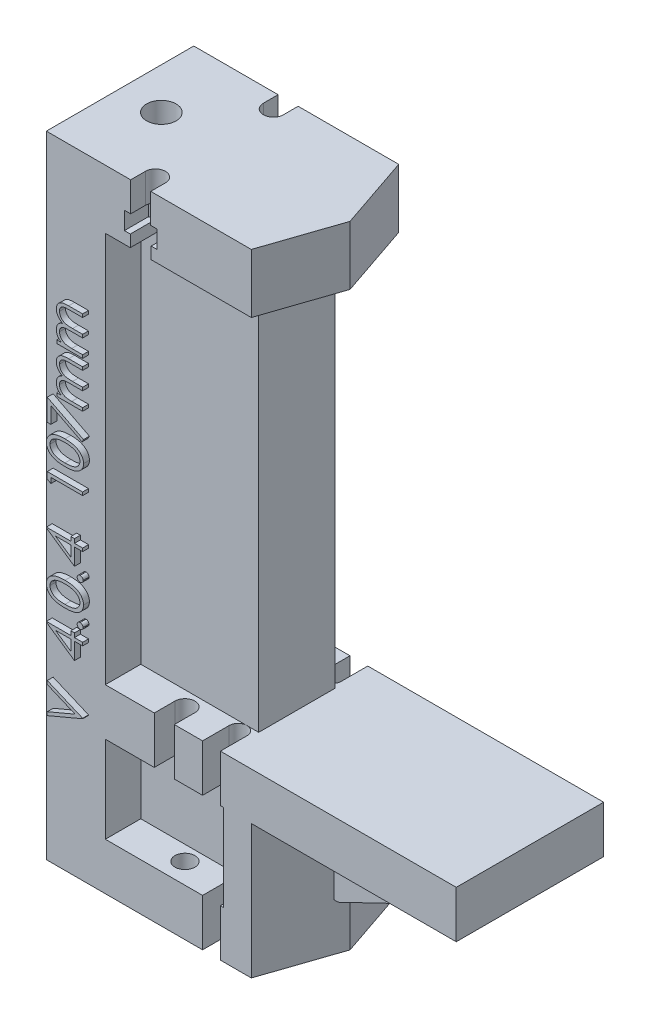
from build123d import *
from build123d.topology import SkipClean

# Parameters (mm, degrees)
BOSS_EXTRUDE2_DEPTH              = 12.5
BOSS_EXTRUDE3_DEPTH              = 25
CUT_EXTRUDE2_REACH               = 112.59
CUT_EXTRUDE3_REACH               = 112.59
CUT_EXTRUDE6_REACH               = 112.59
SKETCH30_W                       = 10
SKETCH30_H                       = 25
CUT_EXTRUDE8_DEPTH               = 8
CUT_EXTRUDE9_DEPTH               = 82.263171394
CUT_EXTRUDE9_DEPTH_BACK          = 82.263171394
BOSS_EXTRUDE6_DEPTH              = 1
BOSS_EXTRUDE7_DEPTH              = 40
BOSS_EXTRUDE17_DEPTH             = 2
CUT_EXTRUDE10_DEPTH              = 3
SKETCH39_W                       = 4
SKETCH39_H                       = 14.695
BOSS_EXTRUDE18_DEPTH             = 2.5
F_5_0MM_DOWEL_HOLE1_D            = 5
F_5_0MM_DOWEL_HOLE1_DEPTH        = 5
F_5_0MM_DOWEL_HOLE1_TIP          = 1.502151548
BOSS_EXTRUDE19_DEPTH             = 2
BOSS_EXTRUDE20_DEPTH             = 8
BOSS_EXTRUDE21_REACH             = 91.364
SKETCH45_W                       = 20
SKETCH45_H                       = 12.98
BOSS_EXTRUDE21_DIRECTION_2_REACH = 91.364


with BuildPart() as part:
    # Sketch6 → Boss-Extrude2 (new, symmetric)
    with BuildSketch(Plane.XY):
        Polygon((-25, 53.5), (15, 53.5), (15, 45.5), (-15, 45.5), (-15, -45.5), (25, -45.5), (25, -53.5), (-25, -53.5), align=None)
    extrude(amount=BOSS_EXTRUDE2_DEPTH, both=True)

    # Sketch15 → Boss-Extrude3 (add)
    with BuildSketch(Plane.XY.offset(12.5)):
        Polygon((-15, -22.805), (15, -22.805), (15, -53.5), (5, -53.5), (5, -30.805), (-15, -30.805), align=None)
    extrude(amount=-BOSS_EXTRUDE3_DEPTH)

    # Sketch20 → Cut-Extrude2 (cut, up to next)
    with BuildSketch(Plane(origin=(0, 53.5, 0), x_dir=(1, 0, 0), z_dir=(0, 1, 0)), mode=Mode.PRIVATE) as cut_extrude2_sk1:
        with BuildLine():
            Line((-10.7, 12.5), (-10.7, 10))
            ThreePointArc((-10.7, 10), (-9, 8.3), (-7.3, 10))
            Line((-7.3, 10), (-7.3, 12.5))
            Line((-7.3, 12.5), (-10.7, 12.5))
        make_face()
    cut_extrude2_tool1 = extrude(cut_extrude2_sk1.sketch, amount=-CUT_EXTRUDE2_REACH, mode=Mode.PRIVATE) & part.part
    # Sketch20 → Cut-Extrude2 (cut, up to next)
    with BuildSketch(Plane(origin=(0, 53.5, 0), x_dir=(1, 0, 0), z_dir=(0, 1, 0)), mode=Mode.PRIVATE) as cut_extrude2_sk2:
        with BuildLine():
            Line((-7.3, -12.5), (-10.7, -12.5))
            Line((-10.7, -12.5), (-10.7, -10))
            ThreePointArc((-10.7, -10), (-9, -8.3), (-7.3, -10))
            Line((-7.3, -10), (-7.3, -12.5))
        make_face()
    cut_extrude2_tool2 = extrude(cut_extrude2_sk2.sketch, amount=-CUT_EXTRUDE2_REACH, mode=Mode.PRIVATE) & part.part
    add(cut_extrude2_tool1.solids().sort_by_distance((-9, 53.5, -10.563642))[0], mode=Mode.SUBTRACT)
    add(cut_extrude2_tool2.solids().sort_by_distance((-9, 53.5, 10.563642))[0], mode=Mode.SUBTRACT)

    # Cut-Extrude3: up to this face of the body (flat: up to its plane)
    cut_extrude3_end = Plane(part.part.faces().sort_by_distance((0, -22.805, 0))[0])
    # Sketch21 → Cut-Extrude3 (cut, up to the picked face)
    with BuildSketch(Plane.XZ.offset(53.5), mode=Mode.PRIVATE) as cut_extrude3_sk1:
        with BuildLine():
            Line((-6.7, 12.5), (-6.7, 9))
            ThreePointArc((-6.7, 9), (-5, 7.3), (-3.3, 9))
            Line((-3.3, 9), (-3.3, 12.5))
            Line((-3.3, 12.5), (-6.7, 12.5))
        make_face()
    cut_extrude3_tool1 = split(extrude(cut_extrude3_sk1.sketch, amount=-CUT_EXTRUDE3_REACH, mode=Mode.PRIVATE), bisect_by=cut_extrude3_end, keep=Keep.BOTH, mode=Mode.PRIVATE)
    # Sketch21 → Cut-Extrude3 (cut, up to the picked face)
    with BuildSketch(Plane.XZ.offset(53.5), mode=Mode.PRIVATE) as cut_extrude3_sk2:
        with BuildLine():
            Line((-3.3, -12.5), (-6.7, -12.5))
            Line((-6.7, -12.5), (-6.7, -9))
            ThreePointArc((-6.7, -9), (-5, -7.3), (-3.3, -9))
            Line((-3.3, -9), (-3.3, -12.5))
        make_face()
    cut_extrude3_tool2 = split(extrude(cut_extrude3_sk2.sketch, amount=-CUT_EXTRUDE3_REACH, mode=Mode.PRIVATE), bisect_by=cut_extrude3_end, keep=Keep.BOTH, mode=Mode.PRIVATE)
    add(cut_extrude3_tool1.solids().sort_by(Axis((-5, -53.5, 10.067524), (0, 1, 0)))[0], mode=Mode.SUBTRACT)
    add(cut_extrude3_tool2.solids().sort_by(Axis((-5, -53.5, -10.067524), (0, 1, 0)))[0], mode=Mode.SUBTRACT)

    # Cut-Extrude6: up to this face of the body (flat: up to its plane)
    cut_extrude6_end = Plane(part.part.faces().sort_by_distance((0.229244521, -22.805, 0))[0])
    # Sketch24 → Cut-Extrude6 (cut, up to the picked face)
    with BuildSketch(Plane.XZ.offset(53.5), mode=Mode.PRIVATE) as cut_extrude6_sk1:
        with BuildLine():
            Line((1.49, -12.5), (1.49, -8))
            ThreePointArc((1.49, -8), (3, -6.49), (4.51, -8))
            Line((4.51, -8), (4.51, -12.5))
            Line((4.51, -12.5), (1.49, -12.5))
        make_face()
    cut_extrude6_tool1 = split(extrude(cut_extrude6_sk1.sketch, amount=-CUT_EXTRUDE6_REACH, mode=Mode.PRIVATE), bisect_by=cut_extrude6_end, keep=Keep.BOTH, mode=Mode.PRIVATE)
    # Sketch24 → Cut-Extrude6 (cut, up to the picked face)
    with BuildSketch(Plane.XZ.offset(53.5), mode=Mode.PRIVATE) as cut_extrude6_sk2:
        with BuildLine():
            Line((4.51, 12.5), (1.49, 12.5))
            Line((1.49, 12.5), (1.49, 8))
            ThreePointArc((1.49, 8), (3, 6.49), (4.51, 8))
            Line((4.51, 8), (4.51, 12.5))
        make_face()
    cut_extrude6_tool2 = split(extrude(cut_extrude6_sk2.sketch, amount=-CUT_EXTRUDE6_REACH, mode=Mode.PRIVATE), bisect_by=cut_extrude6_end, keep=Keep.BOTH, mode=Mode.PRIVATE)
    add(cut_extrude6_tool1.solids().sort_by(Axis((3, -53.5, -9.647036), (0, 1, 0)))[0], mode=Mode.SUBTRACT)
    add(cut_extrude6_tool2.solids().sort_by(Axis((3, -53.5, 9.647036), (0, 1, 0)))[0], mode=Mode.SUBTRACT)

    # Sketch30 → Cut-Extrude8 (cut)
    with BuildSketch(Plane(origin=(0, -45.5, 0), x_dir=(1, 0, 0), z_dir=(0, 1, 0))):
        with Locations((20, 0)):
            Rectangle(SKETCH30_W, SKETCH30_H)
    extrude(amount=-CUT_EXTRUDE8_DEPTH, mode=Mode.SUBTRACT)

    # Sketch34 → Cut-Extrude9 (cut, two sides: drawn at the far end of the back side and taken through both)
    with BuildSketch(Plane(origin=(0, -22.805, 0), x_dir=(1, 0, 0), z_dir=(0, 1, 0)).offset(-CUT_EXTRUDE9_DEPTH_BACK)):
        Polygon((9.755, 12.5), (14, 0), (9.755, -12.5), (15, -12.5), (15, 12.5), align=None)
    extrude(amount=CUT_EXTRUDE9_DEPTH + CUT_EXTRUDE9_DEPTH_BACK, mode=Mode.SUBTRACT)

    # Sketch35 → Boss-Extrude6 (add)
    # profile 1 of 11: a face of its own
    with BuildSketch(Plane.XY.offset(12.5)):
        with BuildLine():
            Line((-22.234615385, 24.192307692), (-22.234615385, 24.730769231))
            Line((-22.234615385, 24.730769231), (-21.472596154, 24.730769231))
            add(Edge.make_bspline(
                [(-21.472596154, 24.730769231), (-21.539260614, 24.779256002), (-21.666996111, 24.872161304), (-21.835322312, 25.024502423), (-21.978170577, 25.176690044), (-22.053158357, 25.286290127), (-22.089182692, 25.338942308)],
                knots=[0, 0, 0, 0, 1.134379233, 2.173579362, 3.122582517, 4, 4, 4, 4], degree=3))
            add(Edge.make_bspline(
                [(-22.089182692, 25.338942308), (-22.123477604, 25.4107103), (-22.191468256, 25.552992414), (-22.260440071, 25.778282514), (-22.302825959, 26.008810519), (-22.308622599, 26.164481742), (-22.311538462, 26.242788462)],
                knots=[0, 0, 0, 0, 1.014936303, 2.012140481, 3.000054389, 4, 4, 4, 4], degree=3))
            add(Edge.make_bspline(
                [(-22.311538462, 26.242788462), (-22.309746507, 26.295747856), (-22.306200324, 26.400551651), (-22.283126386, 26.555839071), (-22.243239974, 26.706452288), (-22.187690322, 26.851510678), (-22.120389321, 26.988153705), (-22.041520642, 27.113523249), (-21.952811526, 27.225533553), (-21.851715073, 27.325979796), (-21.732621113, 27.415508457), (-21.593245652, 27.497285019), (-21.431579845, 27.573850863), (-21.314358593, 27.616020032), (-21.252644231, 27.638221154)],
                knots=[0, 0, 0, 0, 1.009731074, 1.9982035, 2.985760524, 3.974587072, 4.955028184, 5.885388378, 6.793242796, 7.673688873, 8.594941726, 9.625945874, 10.750113716, 12, 12, 12, 12], degree=3))
            add(Edge.make_bspline(
                [(-21.252644231, 27.638221154), (-21.295028488, 27.661726586), (-21.378434755, 27.707981975), (-21.496484081, 27.785642641), (-21.60687165, 27.867038436), (-21.709826129, 27.952731426), (-21.80452798, 28.043081494), (-21.892909205, 28.136632908), (-21.972522012, 28.235480687), (-22.065676161, 28.372206048), (-22.164941217, 28.549911297), (-22.248837086, 28.77483801), (-22.302266055, 29.00792588), (-22.308427236, 29.166379541), (-22.311538462, 29.246394231)],
                knots=[0, 0, 0, 0, 0.861026002, 1.694378253, 2.508904292, 3.297437177, 4.073006284, 4.833627155, 5.583069468, 6.325614666, 7.772320565, 9.187282923, 10.579656144, 12, 12, 12, 12], degree=3))
            add(Edge.make_bspline(
                [(-22.311538462, 29.246394231), (-22.308800813, 29.319918084), (-22.30344297, 29.463811403), (-22.260375554, 29.672941382), (-22.189095041, 29.868811401), (-22.088852441, 30.049345438), (-21.963482389, 30.212445671), (-21.814139706, 30.354757151), (-21.641369838, 30.473150863), (-21.480136821, 30.552300297), (-21.337524673, 30.604991229), (-21.215460368, 30.637898852), (-21.081004779, 30.666408831), (-20.934266049, 30.690580995), (-20.774947077, 30.708056361), (-20.602974661, 30.721047344), (-20.418199364, 30.729827776), (-20.290715767, 30.730449), (-20.225, 30.730769231)],
                knots=[0, 0, 0, 0, 1.209392158, 2.366897878, 3.497663982, 4.628180075, 5.751982922, 6.871462727, 8.009245026, 9.185977379, 9.818124946, 10.509294143, 11.264649411, 12.079922034, 12.956003306, 13.901808055, 14.918415426, 16, 16, 16, 16], degree=3))
            Line((-20.225, 30.730769231), (-17.85, 30.730769231))
            Line((-17.85, 30.730769231), (-17.85, 30.192307692))
            Line((-17.85, 30.192307692), (-20.227403846, 30.192307692))
            add(Edge.make_bspline(
                [(-20.227403846, 30.192307692), (-20.283496341, 30.192174827), (-20.391297586, 30.191919479), (-20.546014988, 30.187293303), (-20.687050044, 30.178620907), (-20.814586843, 30.168324713), (-20.928585361, 30.154407218), (-21.028726359, 30.136031786), (-21.115466742, 30.116719418), (-21.211587244, 30.08455919), (-21.317531947, 30.033623512), (-21.430954892, 29.954624495), (-21.530458078, 29.856584928), (-21.616841526, 29.742755056), (-21.687129696, 29.613262824), (-21.737313417, 29.470517893), (-21.768382244, 29.315438165), (-21.771478124, 29.2080846), (-21.773076923, 29.152644231)],
                knots=[0, 0, 0, 0, 1.253367865, 2.408782419, 3.458086102, 4.410454771, 5.267690823, 6.022776742, 6.685072793, 7.251272234, 8.28433411, 9.300106008, 10.325693114, 11.39283262, 12.482417211, 13.60372085, 14.762494729, 16, 16, 16, 16], degree=3))
            add(Edge.make_bspline(
                [(-21.773076923, 29.152644231), (-21.76997183, 29.084694057), (-21.763840459, 28.950518493), (-21.717743069, 28.753511816), (-21.641126709, 28.566211293), (-21.536341225, 28.389881475), (-21.407618816, 28.229169393), (-21.255294615, 28.090400459), (-21.082742522, 27.975853276), (-20.92307314, 27.898271209), (-20.779638783, 27.849257532), (-20.654327211, 27.816912839), (-20.511520556, 27.791601351), (-20.352893327, 27.768322423), (-20.177094809, 27.752611914), (-19.985210505, 27.738733404), (-19.775926859, 27.732154871), (-19.63085208, 27.731242787), (-19.555528846, 27.730769231)],
                knots=[0, 0, 0, 0, 1.091136677, 2.154576964, 3.231646693, 4.331257757, 5.439166191, 6.528231045, 7.628049365, 8.756709726, 9.369482423, 10.061167346, 10.833871401, 11.698739631, 12.636505159, 13.668922441, 14.789697963, 16, 16, 16, 16], degree=3))
            Line((-19.555528846, 27.730769231), (-17.85, 27.730769231))
            Line((-17.85, 27.730769231), (-17.85, 27.192307692))
            Line((-17.85, 27.192307692), (-20.079567308, 27.192307692))
            add(Edge.make_bspline(
                [(-20.079567308, 27.192307692), (-20.14247014, 27.192171525), (-20.263488866, 27.191909552), (-20.437032312, 27.187321582), (-20.594885583, 27.178601651), (-20.736865264, 27.168520735), (-20.862713168, 27.154017498), (-20.973104451, 27.137543847), (-21.067760922, 27.118088397), (-21.17158701, 27.085879819), (-21.285945136, 27.036637629), (-21.407983755, 26.957527458), (-21.514604324, 26.858340568), (-21.607034555, 26.743272236), (-21.682563185, 26.612793184), (-21.73505501, 26.468346445), (-21.767080197, 26.312298153), (-21.771040318, 26.204484643), (-21.773076923, 26.149038462)],
                knots=[0, 0, 0, 0, 1.320285835, 2.540097241, 3.643286278, 4.638464947, 5.527188413, 6.301437306, 6.980978976, 7.552872752, 8.580906713, 9.583871393, 10.589652407, 11.624542289, 12.671761011, 13.738681301, 14.837052193, 16, 16, 16, 16], degree=3))
            add(Edge.make_bspline(
                [(-21.773076923, 26.149038462), (-21.770453269, 26.08386783), (-21.765224419, 25.953985075), (-21.718160076, 25.763181453), (-21.644438314, 25.578921235), (-21.542166243, 25.404138051), (-21.415474903, 25.243567798), (-21.266504635, 25.10293032), (-21.097243672, 24.985144479), (-20.939930706, 24.906215351), (-20.800047184, 24.855613989), (-20.680645905, 24.822438089), (-20.548314964, 24.793318235), (-20.402780158, 24.771917094), (-20.24469108, 24.751192324), (-20.073236398, 24.741202166), (-19.888570334, 24.731478125), (-19.761074488, 24.731011325), (-19.694951923, 24.730769231)],
                knots=[0, 0, 0, 0, 1.09880202, 2.189873405, 3.297736452, 4.440485332, 5.596193377, 6.739822772, 7.886349079, 9.066114917, 9.699498033, 10.395421758, 11.156987371, 11.985484089, 12.878178647, 13.847820956, 14.883825601, 16, 16, 16, 16], degree=3))
            Line((-19.694951923, 24.730769231), (-17.85, 24.730769231))
            Line((-17.85, 24.730769231), (-17.85, 24.192307692))
            Line((-17.85, 24.192307692), (-22.234615385, 24.192307692))
        make_face()
    # profile 2 of 11: a face of its own
    with BuildSketch(Plane.XY.offset(12.5)):
        with BuildLine():
            Line((-22.234615385, 16.423076923), (-22.234615385, 16.961538462))
            Line((-22.234615385, 16.961538462), (-21.472596154, 16.961538462))
            add(Edge.make_bspline(
                [(-21.472596154, 16.961538462), (-21.539260614, 17.010025233), (-21.666996111, 17.102930535), (-21.835322312, 17.255271654), (-21.978170577, 17.407459275), (-22.053158357, 17.517059358), (-22.089182692, 17.569711538)],
                knots=[0, 0, 0, 0, 1.134379233, 2.173579362, 3.122582517, 4, 4, 4, 4], degree=3))
            add(Edge.make_bspline(
                [(-22.089182692, 17.569711538), (-22.123477604, 17.641479531), (-22.191468256, 17.783761645), (-22.260440071, 18.009051744), (-22.302825959, 18.239579749), (-22.308622599, 18.395250973), (-22.311538462, 18.473557692)],
                knots=[0, 0, 0, 0, 1.014936303, 2.012140481, 3.000054389, 4, 4, 4, 4], degree=3))
            add(Edge.make_bspline(
                [(-22.311538462, 18.473557692), (-22.309746507, 18.526517087), (-22.306200324, 18.631320881), (-22.283126386, 18.786608302), (-22.243239974, 18.937221519), (-22.187690322, 19.082279908), (-22.120389321, 19.218922936), (-22.041520642, 19.344292479), (-21.952811526, 19.456302784), (-21.851715073, 19.556749027), (-21.732621113, 19.646277688), (-21.593245652, 19.72805425), (-21.431579845, 19.804620094), (-21.314358593, 19.846789262), (-21.252644231, 19.868990385)],
                knots=[0, 0, 0, 0, 1.009731074, 1.9982035, 2.985760524, 3.974587072, 4.955028184, 5.885388378, 6.793242796, 7.673688873, 8.594941726, 9.625945874, 10.750113716, 12, 12, 12, 12], degree=3))
            add(Edge.make_bspline(
                [(-21.252644231, 19.868990385), (-21.295028488, 19.892495817), (-21.378434755, 19.938751206), (-21.496484081, 20.016411872), (-21.60687165, 20.097807667), (-21.709826129, 20.183500657), (-21.80452798, 20.273850725), (-21.892909205, 20.367402139), (-21.972522012, 20.466249918), (-22.065676161, 20.602975278), (-22.164941217, 20.780680527), (-22.248837086, 21.005607241), (-22.302266055, 21.238695111), (-22.308427236, 21.397148772), (-22.311538462, 21.477163462)],
                knots=[0, 0, 0, 0, 0.861026002, 1.694378253, 2.508904292, 3.297437177, 4.073006284, 4.833627155, 5.583069468, 6.325614666, 7.772320565, 9.187282923, 10.579656144, 12, 12, 12, 12], degree=3))
            add(Edge.make_bspline(
                [(-22.311538462, 21.477163462), (-22.308800813, 21.550687315), (-22.30344297, 21.694580634), (-22.260375554, 21.903710613), (-22.189095041, 22.099580632), (-22.088852441, 22.280114669), (-21.963482389, 22.443214902), (-21.814139706, 22.585526381), (-21.641369838, 22.703920094), (-21.480136821, 22.783069528), (-21.337524673, 22.83576046), (-21.215460368, 22.868668082), (-21.081004779, 22.897178062), (-20.934266049, 22.921350226), (-20.774947077, 22.938825592), (-20.602974661, 22.951816575), (-20.418199364, 22.960597007), (-20.290715767, 22.961218231), (-20.225, 22.961538462)],
                knots=[0, 0, 0, 0, 1.209392158, 2.366897878, 3.497663982, 4.628180075, 5.751982922, 6.871462727, 8.009245026, 9.185977379, 9.818124946, 10.509294143, 11.264649411, 12.079922034, 12.956003306, 13.901808055, 14.918415426, 16, 16, 16, 16], degree=3))
            Line((-20.225, 22.961538462), (-17.85, 22.961538462))
            Line((-17.85, 22.961538462), (-17.85, 22.423076923))
            Line((-17.85, 22.423076923), (-20.227403846, 22.423076923))
            add(Edge.make_bspline(
                [(-20.227403846, 22.423076923), (-20.283496341, 22.422944058), (-20.391297586, 22.42268871), (-20.546014988, 22.418062534), (-20.687050044, 22.409390138), (-20.814586843, 22.399093944), (-20.928585361, 22.385176449), (-21.028726359, 22.366801017), (-21.115466742, 22.347488649), (-21.211587244, 22.315328421), (-21.317531947, 22.264392743), (-21.430954892, 22.185393726), (-21.530458078, 22.087354159), (-21.616841526, 21.973524286), (-21.687129696, 21.844032054), (-21.737313417, 21.701287124), (-21.768382244, 21.546207396), (-21.771478124, 21.438853831), (-21.773076923, 21.383413462)],
                knots=[0, 0, 0, 0, 1.253367865, 2.408782419, 3.458086102, 4.410454771, 5.267690823, 6.022776742, 6.685072793, 7.251272234, 8.28433411, 9.300106008, 10.325693114, 11.39283262, 12.482417211, 13.60372085, 14.762494729, 16, 16, 16, 16], degree=3))
            add(Edge.make_bspline(
                [(-21.773076923, 21.383413462), (-21.76997183, 21.315463288), (-21.763840459, 21.181287724), (-21.717743069, 20.984281047), (-21.641126709, 20.796980524), (-21.536341225, 20.620650706), (-21.407618816, 20.459938624), (-21.255294615, 20.32116969), (-21.082742522, 20.206622507), (-20.92307314, 20.129040439), (-20.779638783, 20.080026763), (-20.654327211, 20.04768207), (-20.511520556, 20.022370582), (-20.352893327, 19.999091654), (-20.177094809, 19.983381145), (-19.985210505, 19.969502635), (-19.775926859, 19.962924102), (-19.63085208, 19.962012018), (-19.555528846, 19.961538462)],
                knots=[0, 0, 0, 0, 1.091136677, 2.154576964, 3.231646693, 4.331257757, 5.439166191, 6.528231045, 7.628049365, 8.756709726, 9.369482423, 10.061167346, 10.833871401, 11.698739631, 12.636505159, 13.668922441, 14.789697963, 16, 16, 16, 16], degree=3))
            Line((-19.555528846, 19.961538462), (-17.85, 19.961538462))
            Line((-17.85, 19.961538462), (-17.85, 19.423076923))
            Line((-17.85, 19.423076923), (-20.079567308, 19.423076923))
            add(Edge.make_bspline(
                [(-20.079567308, 19.423076923), (-20.14247014, 19.422940756), (-20.263488866, 19.422678783), (-20.437032312, 19.418090813), (-20.594885583, 19.409370882), (-20.736865264, 19.399289966), (-20.862713168, 19.384786728), (-20.973104451, 19.368313078), (-21.067760922, 19.348857627), (-21.17158701, 19.316649049), (-21.285945136, 19.267406859), (-21.407983755, 19.188296688), (-21.514604324, 19.089109799), (-21.607034555, 18.974041467), (-21.682563185, 18.843562414), (-21.73505501, 18.699115676), (-21.767080197, 18.543067384), (-21.771040318, 18.435253873), (-21.773076923, 18.379807692)],
                knots=[0, 0, 0, 0, 1.320285835, 2.540097241, 3.643286278, 4.638464947, 5.527188413, 6.301437306, 6.980978976, 7.552872752, 8.580906713, 9.583871393, 10.589652407, 11.624542289, 12.671761011, 13.738681301, 14.837052193, 16, 16, 16, 16], degree=3))
            add(Edge.make_bspline(
                [(-21.773076923, 18.379807692), (-21.770453269, 18.314637061), (-21.765224419, 18.184754306), (-21.718160076, 17.993950684), (-21.644438314, 17.809690466), (-21.542166243, 17.634907282), (-21.415474903, 17.474337029), (-21.266504635, 17.333699551), (-21.097243672, 17.215913709), (-20.939930706, 17.136984582), (-20.800047184, 17.08638322), (-20.680645905, 17.05320732), (-20.548314964, 17.024087466), (-20.402780158, 17.002686325), (-20.24469108, 16.981961555), (-20.073236398, 16.971971397), (-19.888570334, 16.962247356), (-19.761074488, 16.961780556), (-19.694951923, 16.961538462)],
                knots=[0, 0, 0, 0, 1.09880202, 2.189873405, 3.297736452, 4.440485332, 5.596193377, 6.739822772, 7.886349079, 9.066114917, 9.699498033, 10.395421758, 11.156987371, 11.985484089, 12.878178647, 13.847820956, 14.883825601, 16, 16, 16, 16], degree=3))
            Line((-19.694951923, 16.961538462), (-17.85, 16.961538462))
            Line((-17.85, 16.961538462), (-17.85, 16.423076923))
            Line((-17.85, 16.423076923), (-22.234615385, 16.423076923))
        make_face()
    # profile 3 of 11: a face of its own
    with BuildSketch(Plane.XY.offset(12.5)):
        Polygon((-23.85, 11.807692308), (-23.85, 15.5), (-17.696153846, 12.346153846), (-17.952163462, 11.881009615), (-23.234615385, 14.588942308), (-23.234615385, 11.807692308), align=None)
    # profile 4 of 11: a face of its own
    with BuildSketch(Plane.XY.offset(12.5)):
        with BuildLine():
            add(Edge.make_bspline(
                [(-20.847596154, 6.807692308), (-20.943763104, 6.808254625), (-21.130568792, 6.809346933), (-21.402771035, 6.821498512), (-21.658131531, 6.841684813), (-21.8966625, 6.869348882), (-22.118425529, 6.903013987), (-22.322827956, 6.947954834), (-22.5108159, 6.999062452), (-22.683002111, 7.058295363), (-22.841707287, 7.125131068), (-22.989862864, 7.197877295), (-23.12725581, 7.279410631), (-23.256039225, 7.365107901), (-23.374246225, 7.458305288), (-23.483238776, 7.557004464), (-23.582097725, 7.663179426), (-23.67089077, 7.775800373), (-23.748749314, 7.894104021), (-23.817752138, 8.014857575), (-23.874589397, 8.14021863), (-23.921083839, 8.26853688), (-23.959038325, 8.400082771), (-23.985109169, 8.53482272), (-24.001483733, 8.673069065), (-24.003051209, 8.766379549), (-24.003846154, 8.813701923)],
                knots=[0, 0, 0, 0, 1.646148282, 3.197666765, 4.66315463, 6.030252048, 7.307778049, 8.501004361, 9.610818041, 10.641065266, 11.615491391, 12.557119604, 13.464013759, 14.348536654, 15.203310953, 16.038349431, 16.863300206, 17.683791446, 18.490318933, 19.285717724, 20.06220424, 20.843281102, 21.620494212, 22.403315558, 23.190242141, 24, 24, 24, 24], degree=3))
            add(Edge.make_bspline(
                [(-24.003846154, 8.813701923), (-24.003184011, 8.861443028), (-24.00186658, 8.956431023), (-23.983322948, 9.096359849), (-23.959388145, 9.233851353), (-23.921000663, 9.366819518), (-23.875065063, 9.497778517), (-23.814453767, 9.62347166), (-23.748534277, 9.748336583), (-23.668118043, 9.866700838), (-23.579244872, 9.982100932), (-23.478351101, 10.090276472), (-23.368228979, 10.193992714), (-23.246422458, 10.289332334), (-23.114799194, 10.380381458), (-22.972255805, 10.463683769), (-22.819108188, 10.540971802), (-22.656066311, 10.613698368), (-22.478775073, 10.677295829), (-22.288340287, 10.733839056), (-22.083037474, 10.780185797), (-21.8640103, 10.818513738), (-21.630173709, 10.848263516), (-21.382001479, 10.869914901), (-21.119338352, 10.881355776), (-20.939753411, 10.883509938), (-20.847596154, 10.884615385)],
                knots=[0, 0, 0, 0, 0.810910589, 1.61342667, 2.396193133, 3.181089899, 3.963115317, 4.752255436, 5.550715454, 6.36105385, 7.181178335, 8.024612154, 8.872680183, 9.750181803, 10.651284446, 11.591556747, 12.554036451, 13.566402641, 14.62422919, 15.753422176, 16.94128843, 18.199818041, 19.531985927, 20.947085226, 22.433341622, 24, 24, 24, 24], degree=3))
            add(Edge.make_bspline(
                [(-20.847596154, 10.884615385), (-20.755841687, 10.883485617), (-20.576661658, 10.881279384), (-20.315168068, 10.870160276), (-20.06833354, 10.847734672), (-19.835894914, 10.820092294), (-19.61774442, 10.781335965), (-19.414024206, 10.734637795), (-19.22401301, 10.681432174), (-19.049072236, 10.616858663), (-18.886313286, 10.545824867), (-18.734291753, 10.46861977), (-18.591786008, 10.385787548), (-18.459815568, 10.296103949), (-18.338497958, 10.199196089), (-18.227998136, 10.095552543), (-18.126462639, 9.986432504), (-18.036610349, 9.870359647), (-17.955581867, 9.750892902), (-17.887270195, 9.626015294), (-17.828082139, 9.498922777), (-17.779690445, 9.368346453), (-17.74216212, 9.234487925), (-17.716363441, 9.096902184), (-17.698228951, 8.956411277), (-17.696847943, 8.861436423), (-17.696153846, 8.813701923)],
                knots=[0, 0, 0, 0, 1.561645053, 3.049612875, 4.452756685, 5.778837748, 7.032101753, 8.221335837, 9.334924186, 10.387562255, 11.392109817, 12.355697819, 13.287721948, 14.19548756, 15.068665045, 15.927346723, 16.771751757, 17.602390507, 18.423119567, 19.225778204, 20.022010933, 20.807278863, 21.593079439, 22.384715467, 23.188155646, 24, 24, 24, 24], degree=3))
            add(Edge.make_bspline(
                [(-17.696153846, 8.813701923), (-17.696953313, 8.766380585), (-17.698529705, 8.673072142), (-17.714838958, 8.534810841), (-17.741059822, 8.400612368), (-17.777773997, 8.269814499), (-17.82271373, 8.141746208), (-17.88126285, 8.018152496), (-17.948692879, 7.897659616), (-18.025484279, 7.780587265), (-18.113467177, 7.669142095), (-18.210766452, 7.562671154), (-18.319877187, 7.463947639), (-18.439081549, 7.371558356), (-18.568056572, 7.284955113), (-18.706888809, 7.204126332), (-18.855815319, 7.129854561), (-19.015774756, 7.06187698), (-19.189183067, 7.001607269), (-19.377650209, 6.948575809), (-19.583090447, 6.90622121), (-19.80446072, 6.87031914), (-20.042210834, 6.841550341), (-20.296426807, 6.821506894), (-20.566625901, 6.809356158), (-20.752230327, 6.808257045), (-20.847596154, 6.807692308)],
                knots=[0, 0, 0, 0, 0.810927267, 1.598990287, 2.382942141, 3.152806972, 3.926217614, 4.706701772, 5.493896336, 6.292070767, 7.104102563, 7.925577746, 8.761822141, 9.623241997, 10.509042271, 11.423174113, 12.375371989, 13.360203808, 14.400680605, 15.520553799, 16.714061498, 17.994519714, 19.364400916, 20.818312473, 22.365209998, 24, 24, 24, 24], degree=3))
        make_face()
        with BuildLine():
            add(Edge.make_bspline(
                [(-20.85, 7.346153846), (-20.769859694, 7.346363103), (-20.614323096, 7.346769228), (-20.388701112, 7.357071927), (-20.177909913, 7.371412233), (-19.982031768, 7.389453163), (-19.801751265, 7.416472021), (-19.636318913, 7.447126567), (-19.486040925, 7.483894824), (-19.349604048, 7.527612784), (-19.225076282, 7.577411794), (-19.109138521, 7.631688098), (-19.000416685, 7.690512961), (-18.899174551, 7.755092167), (-18.806649691, 7.826702492), (-18.720496813, 7.902024071), (-18.643712237, 7.984450102), (-18.551605787, 8.098451448), (-18.456431673, 8.248962083), (-18.373552195, 8.438596427), (-18.321468101, 8.63345681), (-18.314844504, 8.765716072), (-18.311538462, 8.831730769)],
                knots=[0, 0, 0, 0, 1.459098681, 2.831824031, 4.11146945, 5.306290378, 6.412266529, 7.42953815, 8.369053297, 9.227277979, 10.03601793, 10.809473603, 11.557037441, 12.285528272, 12.993193355, 13.685654407, 14.36688038, 15.041354379, 16.352855396, 17.594313975, 18.799247529, 20, 20, 20, 20], degree=3))
            add(Edge.make_bspline(
                [(-18.311538462, 8.831730769), (-18.314433297, 8.8981276), (-18.320212699, 9.030685739), (-18.370653042, 9.225367123), (-18.452653022, 9.4128011), (-18.546336056, 9.560722008), (-18.636124672, 9.67294532), (-18.712589838, 9.75338114), (-18.798233217, 9.827199934), (-18.89063069, 9.897215436), (-18.991555316, 9.961430851), (-19.100519627, 10.019824842), (-19.217826818, 10.073110569), (-19.299717795, 10.103468935), (-19.341586538, 10.118990385)],
                knots=[0, 0, 0, 0, 1.353621445, 2.702441307, 4.075953605, 5.516772412, 6.261413105, 7.007624062, 7.778524365, 8.566925914, 9.372323995, 10.217594641, 11.088702136, 12, 12, 12, 12], degree=3))
            add(Edge.make_bspline(
                [(-19.341586538, 10.118990385), (-19.395123235, 10.137079129), (-19.503825688, 10.173807039), (-19.672449091, 10.221141509), (-19.849368115, 10.258419336), (-20.033525458, 10.291956535), (-20.226279231, 10.314847488), (-20.427033032, 10.33327231), (-20.635938225, 10.344124917), (-20.777872495, 10.345470204), (-20.85, 10.346153846)],
                knots=[0, 0, 0, 0, 0.884706709, 1.796334032, 2.740027952, 3.714592787, 4.726048262, 5.777819803, 6.87074269, 8, 8, 8, 8], degree=3))
            add(Edge.make_bspline(
                [(-20.85, 10.346153846), (-20.922115839, 10.345210665), (-21.063189835, 10.3433656), (-21.269792431, 10.336313049), (-21.466022878, 10.318101208), (-21.652726545, 10.297874146), (-21.828869925, 10.268050342), (-21.995927577, 10.235894088), (-22.151829954, 10.192692057), (-22.299017639, 10.146543708), (-22.435819346, 10.093726455), (-22.562869531, 10.035583233), (-22.680793265, 9.973495653), (-22.789226195, 9.906027824), (-22.888797281, 9.834119505), (-22.977215398, 9.755192469), (-23.058781601, 9.674259166), (-23.150223336, 9.559154948), (-23.244194815, 9.40968862), (-23.328320624, 9.222419092), (-23.378108547, 9.028603204), (-23.38501303, 8.897307597), (-23.388461538, 8.831730769)],
                knots=[0, 0, 0, 0, 1.313483664, 2.569454835, 3.763100662, 4.901599063, 5.988328865, 7.015709358, 7.99797933, 8.932480776, 9.824041341, 10.666387587, 11.475829342, 12.24921787, 12.990555181, 13.709176526, 14.405678811, 15.080244297, 16.38186033, 17.610124501, 18.806354173, 20, 20, 20, 20], degree=3))
            add(Edge.make_bspline(
                [(-23.388461538, 8.831730769), (-23.38500445, 8.765359674), (-23.378083976, 8.63249657), (-23.328550878, 8.436610909), (-23.24444095, 8.248076263), (-23.150404383, 8.09811705), (-23.059132198, 7.984411155), (-22.981449059, 7.903722786), (-22.897353903, 7.827356599), (-22.804008242, 7.757600615), (-22.703122835, 7.693404346), (-22.595806963, 7.632306111), (-22.479652573, 7.578755625), (-22.355222453, 7.528796737), (-22.218778072, 7.485005857), (-22.067956326, 7.448657718), (-21.90212891, 7.415567035), (-21.720531175, 7.39173635), (-21.524611224, 7.37075185), (-21.313280962, 7.357229358), (-21.086884212, 7.346722031), (-20.930542894, 7.346347035), (-20.85, 7.346153846)],
                knots=[0, 0, 0, 0, 1.207546505, 2.417292871, 3.651582144, 4.952510111, 5.626719005, 6.30238548, 6.989136872, 7.692112372, 8.420316868, 9.164734959, 9.937886623, 10.746308695, 11.604196049, 12.543341915, 13.568754172, 14.680483261, 15.875568977, 17.154711427, 18.534182925, 20, 20, 20, 20], degree=3))
        make_face(mode=Mode.SUBTRACT)
    # profile 5 of 11: a face of its own
    with BuildSketch(Plane.XY.offset(12.5)):
        Polygon((-23.85, 3.467548077), (-23.85, 4.576923077), (-17.85, 4.576923077), (-17.85, 4.038461538), (-23.234615385, 4.038461538), (-23.234615385, 3.115384615), align=None)
    # profile 6 of 11: a face of its own
    with BuildSketch(Plane.XY.offset(12.5)):
        Polygon((-24.003846154, -3.763221154), (-24.003846154, -3.653846154), (-19.85, -3.653846154), (-19.85, -2.961538462), (-19.234615385, -2.961538462), (-19.234615385, -3.653846154), (-17.85, -3.653846154), (-17.85, -4.192307692), (-19.234615385, -4.192307692), (-19.234615385, -7.038461538), align=None)
        Polygon((-19.85, -4.192307692), (-22.455769231, -4.192307692), (-19.85, -5.980769231), align=None, mode=Mode.SUBTRACT)
    # profile 7 of 11: a face of its own
    with BuildSketch(Plane.XY.offset(12.5)):
        with BuildLine():
            add(Edge.make_bspline(
                [(-18.773076923, -8.384615385), (-18.771091494, -8.351203592), (-18.767199294, -8.28570368), (-18.740496425, -8.191008031), (-18.693081578, -8.1053029), (-18.629888244, -8.028961909), (-18.553267107, -7.966036521), (-18.468245549, -7.916931917), (-18.372757105, -7.890461657), (-18.306877662, -7.886597808), (-18.273076923, -7.884615385)],
                knots=[0, 0, 0, 0, 1.020151414, 1.999887582, 2.974338812, 3.990962822, 5.007586832, 5.987933904, 6.967670073, 8, 8, 8, 8], degree=3))
            add(Edge.make_bspline(
                [(-18.273076923, -7.884615385), (-18.240082695, -7.886658673), (-18.17501856, -7.890688008), (-18.080332316, -7.91694386), (-17.995213248, -7.965976911), (-17.918771705, -8.029362272), (-17.854052036, -8.104846357), (-17.807265803, -8.191276168), (-17.778559122, -8.285464217), (-17.774926676, -8.351160715), (-17.773076923, -8.384615385)],
                knots=[0, 0, 0, 0, 1.009624703, 1.990965087, 2.972917375, 3.991206001, 5.017354006, 5.993400798, 6.978178195, 8, 8, 8, 8], degree=3))
            add(Edge.make_bspline(
                [(-17.773076923, -8.384615385), (-17.774859529, -8.418094148), (-17.778339643, -8.483453465), (-17.807852551, -8.577290359), (-17.853605582, -8.664246963), (-17.918889524, -8.739711432), (-17.994817845, -8.803610445), (-18.080918523, -8.850468116), (-18.174747202, -8.879000461), (-18.240029244, -8.882728262), (-18.273076923, -8.884615385)],
                knots=[0, 0, 0, 0, 1.022258411, 1.995716197, 2.98297171, 4.009558169, 5.028281891, 6.00474573, 6.989943903, 8, 8, 8, 8], degree=3))
            add(Edge.make_bspline(
                [(-18.273076923, -8.884615385), (-18.306933002, -8.882794643), (-18.373032842, -8.879239869), (-18.467659884, -8.850481594), (-18.553662923, -8.803550945), (-18.629771346, -8.740113125), (-18.693521007, -8.66378576), (-18.739917796, -8.577563694), (-18.767415645, -8.483210197), (-18.771157102, -8.418050302), (-18.773076923, -8.384615385)],
                knots=[0, 0, 0, 0, 1.032775665, 2.016367738, 2.991239715, 4.008302682, 5.025365648, 6.011011707, 6.979408107, 8, 8, 8, 8], degree=3))
        make_face()
    # profile 8 of 11: a face of its own
    with BuildSketch(Plane.XY.offset(12.5)):
        with BuildLine():
            add(Edge.make_bspline(
                [(-20.847596154, -13.961538462), (-20.943763104, -13.960976145), (-21.130568792, -13.959883836), (-21.402771035, -13.947732257), (-21.658131531, -13.927545957), (-21.8966625, -13.899881888), (-22.118425529, -13.866216783), (-22.322827956, -13.821275935), (-22.5108159, -13.770168317), (-22.683002111, -13.710935407), (-22.841707287, -13.644099701), (-22.989862864, -13.571353475), (-23.12725581, -13.489820138), (-23.256039225, -13.404122868), (-23.374246225, -13.310925481), (-23.483238776, -13.212226305), (-23.582097725, -13.106051343), (-23.67089077, -12.993430396), (-23.748749314, -12.875126748), (-23.817752138, -12.754373195), (-23.874589397, -12.629012139), (-23.921083839, -12.500693889), (-23.959038325, -12.369147998), (-23.985109169, -12.234408049), (-24.001483733, -12.096161704), (-24.003051209, -12.00285122), (-24.003846154, -11.955528846)],
                knots=[0, 0, 0, 0, 1.646148282, 3.197666765, 4.66315463, 6.030252048, 7.307778049, 8.501004361, 9.610818041, 10.641065266, 11.615491391, 12.557119604, 13.464013759, 14.348536654, 15.203310953, 16.038349431, 16.863300206, 17.683791446, 18.490318933, 19.285717724, 20.06220424, 20.843281102, 21.620494212, 22.403315558, 23.190242141, 24, 24, 24, 24], degree=3))
            add(Edge.make_bspline(
                [(-24.003846154, -11.955528846), (-24.003184011, -11.907787742), (-24.00186658, -11.812799746), (-23.983322948, -11.67287092), (-23.959388145, -11.535379416), (-23.921000663, -11.402411251), (-23.875065063, -11.271452253), (-23.814453767, -11.145759109), (-23.748534277, -11.020894186), (-23.668118043, -10.902529931), (-23.579244872, -10.787129837), (-23.478351101, -10.678954297), (-23.368228979, -10.575238056), (-23.246422458, -10.479898435), (-23.114799194, -10.388849311), (-22.972255805, -10.305547), (-22.819108188, -10.228258967), (-22.656066311, -10.155532402), (-22.478775073, -10.09193494), (-22.288340287, -10.035391714), (-22.083037474, -9.989044972), (-21.8640103, -9.950717032), (-21.630173709, -9.920967254), (-21.382001479, -9.899315868), (-21.119338352, -9.887874993), (-20.939753411, -9.885720832), (-20.847596154, -9.884615385)],
                knots=[0, 0, 0, 0, 0.810910589, 1.61342667, 2.396193133, 3.181089899, 3.963115317, 4.752255436, 5.550715454, 6.36105385, 7.181178335, 8.024612154, 8.872680183, 9.750181803, 10.651284446, 11.591556747, 12.554036451, 13.566402641, 14.62422919, 15.753422176, 16.94128843, 18.199818041, 19.531985927, 20.947085226, 22.433341622, 24, 24, 24, 24], degree=3))
            add(Edge.make_bspline(
                [(-20.847596154, -9.884615385), (-20.755841687, -9.885745152), (-20.576661658, -9.887951385), (-20.315168068, -9.899070493), (-20.06833354, -9.921496097), (-19.835894914, -9.949138476), (-19.61774442, -9.987894804), (-19.414024206, -10.034592974), (-19.22401301, -10.087798595), (-19.049072236, -10.152372106), (-18.886313286, -10.223405902), (-18.734291753, -10.300610999), (-18.591786008, -10.383443221), (-18.459815568, -10.47312682), (-18.338497958, -10.57003468), (-18.227998136, -10.673678226), (-18.126462639, -10.782798265), (-18.036610349, -10.898871122), (-17.955581867, -11.018337867), (-17.887270195, -11.143215475), (-17.828082139, -11.270307993), (-17.779690445, -11.400884316), (-17.74216212, -11.534742844), (-17.716363441, -11.672328586), (-17.698228951, -11.812819492), (-17.696847943, -11.907794346), (-17.696153846, -11.955528846)],
                knots=[0, 0, 0, 0, 1.561645053, 3.049612875, 4.452756685, 5.778837748, 7.032101753, 8.221335837, 9.334924186, 10.387562255, 11.392109817, 12.355697819, 13.287721948, 14.19548756, 15.068665045, 15.927346723, 16.771751757, 17.602390507, 18.423119567, 19.225778204, 20.022010933, 20.807278863, 21.593079439, 22.384715467, 23.188155646, 24, 24, 24, 24], degree=3))
            add(Edge.make_bspline(
                [(-17.696153846, -11.955528846), (-17.696953313, -12.002850184), (-17.698529705, -12.096158627), (-17.714838958, -12.234419928), (-17.741059822, -12.368618401), (-17.777773997, -12.49941627), (-17.82271373, -12.627484562), (-17.88126285, -12.751078273), (-17.948692879, -12.871571153), (-18.025484279, -12.988643504), (-18.113467177, -13.100088674), (-18.210766452, -13.206559615), (-18.319877187, -13.30528313), (-18.439081549, -13.397672413), (-18.568056572, -13.484275657), (-18.706888809, -13.565104437), (-18.855815319, -13.639376208), (-19.015774756, -13.707353789), (-19.189183067, -13.7676235), (-19.377650209, -13.82065496), (-19.583090447, -13.863009559), (-19.80446072, -13.898911629), (-20.042210834, -13.927680428), (-20.296426807, -13.947723875), (-20.566625901, -13.959874611), (-20.752230327, -13.960973724), (-20.847596154, -13.961538462)],
                knots=[0, 0, 0, 0, 0.810927267, 1.598990287, 2.382942141, 3.152806972, 3.926217614, 4.706701772, 5.493896336, 6.292070767, 7.104102563, 7.925577746, 8.761822141, 9.623241997, 10.509042271, 11.423174113, 12.375371989, 13.360203808, 14.400680605, 15.520553799, 16.714061498, 17.994519714, 19.364400916, 20.818312473, 22.365209998, 24, 24, 24, 24], degree=3))
        make_face()
        with BuildLine():
            add(Edge.make_bspline(
                [(-20.85, -13.423076923), (-20.769859694, -13.422867667), (-20.614323096, -13.422461541), (-20.388701112, -13.412158842), (-20.177909913, -13.397818537), (-19.982031768, -13.379777607), (-19.801751265, -13.352758749), (-19.636318913, -13.322104202), (-19.486040925, -13.285335945), (-19.349604048, -13.241617985), (-19.225076282, -13.191818975), (-19.109138521, -13.137542672), (-19.000416685, -13.078717808), (-18.899174551, -13.014138602), (-18.806649691, -12.942528278), (-18.720496813, -12.867206698), (-18.643712237, -12.784780668), (-18.551605787, -12.670779321), (-18.456431673, -12.520268686), (-18.373552195, -12.330634343), (-18.321468101, -12.13577396), (-18.314844504, -12.003514698), (-18.311538462, -11.9375)],
                knots=[0, 0, 0, 0, 1.459098681, 2.831824031, 4.11146945, 5.306290378, 6.412266529, 7.42953815, 8.369053297, 9.227277979, 10.03601793, 10.809473603, 11.557037441, 12.285528272, 12.993193355, 13.685654407, 14.36688038, 15.041354379, 16.352855396, 17.594313975, 18.799247529, 20, 20, 20, 20], degree=3))
            add(Edge.make_bspline(
                [(-18.311538462, -11.9375), (-18.314433297, -11.871103169), (-18.320212699, -11.73854503), (-18.370653042, -11.543863646), (-18.452653022, -11.356429669), (-18.546336056, -11.208508762), (-18.636124672, -11.096285449), (-18.712589838, -11.015849629), (-18.798233217, -10.942030835), (-18.89063069, -10.872015333), (-18.991555316, -10.807799918), (-19.100519627, -10.749405927), (-19.217826818, -10.6961202), (-19.299717795, -10.665761834), (-19.341586538, -10.650240385)],
                knots=[0, 0, 0, 0, 1.353621445, 2.702441307, 4.075953605, 5.516772412, 6.261413105, 7.007624062, 7.778524365, 8.566925914, 9.372323995, 10.217594641, 11.088702136, 12, 12, 12, 12], degree=3))
            add(Edge.make_bspline(
                [(-19.341586538, -10.650240385), (-19.395123235, -10.63215164), (-19.503825688, -10.59542373), (-19.672449091, -10.54808926), (-19.849368115, -10.510811433), (-20.033525458, -10.477274235), (-20.226279231, -10.454383282), (-20.427033032, -10.435958459), (-20.635938225, -10.425105853), (-20.777872495, -10.423760565), (-20.85, -10.423076923)],
                knots=[0, 0, 0, 0, 0.884706709, 1.796334032, 2.740027952, 3.714592787, 4.726048262, 5.777819803, 6.87074269, 8, 8, 8, 8], degree=3))
            add(Edge.make_bspline(
                [(-20.85, -10.423076923), (-20.922115839, -10.424020105), (-21.063189835, -10.425865169), (-21.269792431, -10.43291772), (-21.466022878, -10.451129561), (-21.652726545, -10.471356623), (-21.828869925, -10.501180427), (-21.995927577, -10.533336681), (-22.151829954, -10.576538712), (-22.299017639, -10.622687062), (-22.435819346, -10.675504314), (-22.562869531, -10.733647536), (-22.680793265, -10.795735116), (-22.789226195, -10.863202945), (-22.888797281, -10.935111264), (-22.977215398, -11.0140383), (-23.058781601, -11.094971604), (-23.150223336, -11.210075821), (-23.244194815, -11.359542149), (-23.328320624, -11.546811677), (-23.378108547, -11.740627565), (-23.38501303, -11.871923172), (-23.388461538, -11.9375)],
                knots=[0, 0, 0, 0, 1.313483664, 2.569454835, 3.763100662, 4.901599063, 5.988328865, 7.015709358, 7.99797933, 8.932480776, 9.824041341, 10.666387587, 11.475829342, 12.24921787, 12.990555181, 13.709176526, 14.405678811, 15.080244297, 16.38186033, 17.610124501, 18.806354173, 20, 20, 20, 20], degree=3))
            add(Edge.make_bspline(
                [(-23.388461538, -11.9375), (-23.38500445, -12.003871096), (-23.378083976, -12.136734199), (-23.328550878, -12.33261986), (-23.24444095, -12.521154506), (-23.150404383, -12.67111372), (-23.059132198, -12.784819614), (-22.981449059, -12.865507984), (-22.897353903, -12.94187417), (-22.804008242, -13.011630154), (-22.703122835, -13.075826424), (-22.595806963, -13.136924658), (-22.479652573, -13.190475144), (-22.355222453, -13.240434032), (-22.218778072, -13.284224912), (-22.067956326, -13.320573051), (-21.90212891, -13.353663734), (-21.720531175, -13.377494419), (-21.524611224, -13.39847892), (-21.313280962, -13.412001412), (-21.086884212, -13.422508738), (-20.930542894, -13.422883735), (-20.85, -13.423076923)],
                knots=[0, 0, 0, 0, 1.207546505, 2.417292871, 3.651582144, 4.952510111, 5.626719005, 6.30238548, 6.989136872, 7.692112372, 8.420316868, 9.164734959, 9.937886623, 10.746308695, 11.604196049, 12.543341915, 13.568754172, 14.680483261, 15.875568977, 17.154711427, 18.534182925, 20, 20, 20, 20], degree=3))
        make_face(mode=Mode.SUBTRACT)
    # profile 9 of 11: a face of its own
    with BuildSketch(Plane.XY.offset(12.5)):
        with BuildLine():
            add(Edge.make_bspline(
                [(-18.773076923, -15.307692308), (-18.771091494, -15.274280515), (-18.767199294, -15.208780603), (-18.740496425, -15.114084954), (-18.693081578, -15.028379823), (-18.629888244, -14.952038832), (-18.553267107, -14.889113444), (-18.468245549, -14.84000884), (-18.372757105, -14.81353858), (-18.306877662, -14.809674731), (-18.273076923, -14.807692308)],
                knots=[0, 0, 0, 0, 1.020151414, 1.999887582, 2.974338812, 3.990962822, 5.007586832, 5.987933904, 6.967670073, 8, 8, 8, 8], degree=3))
            add(Edge.make_bspline(
                [(-18.273076923, -14.807692308), (-18.240082695, -14.809735596), (-18.17501856, -14.813764931), (-18.080332316, -14.840020783), (-17.995213248, -14.889053834), (-17.918771705, -14.952439196), (-17.854052036, -15.027923281), (-17.807265803, -15.114353091), (-17.778559122, -15.20854114), (-17.774926676, -15.274237638), (-17.773076923, -15.307692308)],
                knots=[0, 0, 0, 0, 1.009624703, 1.990965087, 2.972917375, 3.991206001, 5.017354006, 5.993400798, 6.978178195, 8, 8, 8, 8], degree=3))
            add(Edge.make_bspline(
                [(-17.773076923, -15.307692308), (-17.774859529, -15.341171071), (-17.778339643, -15.406530388), (-17.807852551, -15.500367282), (-17.853605582, -15.587323886), (-17.918889524, -15.662788355), (-17.994817845, -15.726687369), (-18.080918523, -15.773545039), (-18.174747202, -15.802077384), (-18.240029244, -15.805805185), (-18.273076923, -15.807692308)],
                knots=[0, 0, 0, 0, 1.022258411, 1.995716197, 2.98297171, 4.009558169, 5.028281891, 6.00474573, 6.989943903, 8, 8, 8, 8], degree=3))
            add(Edge.make_bspline(
                [(-18.273076923, -15.807692308), (-18.306933002, -15.805871566), (-18.373032842, -15.802316792), (-18.467659884, -15.773558517), (-18.553662923, -15.726627868), (-18.629771346, -15.663190048), (-18.693521007, -15.586862684), (-18.739917796, -15.500640618), (-18.767415645, -15.40628712), (-18.771157102, -15.341127225), (-18.773076923, -15.307692308)],
                knots=[0, 0, 0, 0, 1.032775665, 2.016367738, 2.991239715, 4.008302682, 5.025365648, 6.011011707, 6.979408107, 8, 8, 8, 8], degree=3))
        make_face()
    # profile 10 of 11: a face of its own
    with BuildSketch(Plane.XY.offset(12.5)):
        Polygon((-24.003846154, -17.609375), (-24.003846154, -17.5), (-19.85, -17.5), (-19.85, -16.807692308), (-19.234615385, -16.807692308), (-19.234615385, -17.5), (-17.85, -17.5), (-17.85, -18.038461538), (-19.234615385, -18.038461538), (-19.234615385, -20.884615385), align=None)
        Polygon((-19.85, -18.038461538), (-22.455769231, -18.038461538), (-19.85, -19.826923077), align=None, mode=Mode.SUBTRACT)
    # profile 11 of 11: a face of its own
    with BuildSketch(Plane.XY.offset(12.5)):
        Polygon((-23.85, -31.269230769), (-23.85, -30.692307692), (-19.121634615, -28.692307692), (-23.85, -26.692307692), (-23.85, -26.115384615), (-17.85, -28.653846154), (-17.85, -28.730769231), align=None)
    extrude(amount=BOSS_EXTRUDE6_DEPTH)

    # 3DSketch1 → Boss-Extrude7 (add)
    with BuildSketch(Plane(origin=(4.51, -22.805, 12.5), x_dir=(0, -0.304775727103784, -0.9524241471993241), z_dir=(-1, 0, 0))):
        Polygon((0, 0), (2.438205817, 7.619393178), (26.248809497, 0), (23.81060368, -7.619393178), align=None)
    extrude(amount=-BOSS_EXTRUDE7_DEPTH)

    # Sketch38 → Cut-Extrude10 (cut)
    with BuildSketch(Plane.XZ.offset(-45.5)):
        Polygon((-9, 6.824573519), (-6.25, 8.41228676), (-6.23, 8.423833765), (-6.23, 12.5), (-11.77, 12.5), (-11.77, 8.423833765), (-11.75, 8.41228676), align=None)
        Polygon((-6.25, -8.41228676), (-9, -6.824573519), (-11.75, -8.41228676), (-11.77, -8.423833765), (-11.77, -12.5), (-6.23, -12.5), (-6.23, -8.423833765), align=None)
    extrude(amount=-CUT_EXTRUDE10_DEPTH, mode=Mode.SUBTRACT)



with BuildPart() as body_2:
    # Sketch37 → Boss-Extrude17 (new, symmetric)
    with BuildSketch(Plane.XY):
        Polygon((14, -30.805), (44.51, -30.805), (14, -45.5), align=None)
    extrude(amount=BOSS_EXTRUDE17_DEPTH, both=True)


with BuildPart() as part_1:
    add(part.part)

    add(body_2.part)  # Boss-Extrude18 merges body 2
    # Sketch39 → Boss-Extrude18 (add)
    with BuildSketch(Plane.ZY.offset(-14)):
        with Locations((0, -38.1525)):
            Rectangle(SKETCH39_W, SKETCH39_H)
    extrude(amount=BOSS_EXTRUDE18_DEPTH)

    # Ø5.0mm Dowel Hole1
    with Locations(Plane(origin=(0, 53.5, 0), x_dir=(1, 0, 0), z_dir=(0, 1, 0))):
        with Locations((-18, 0)):
            Hole(F_5_0MM_DOWEL_HOLE1_D / 2, depth=F_5_0MM_DOWEL_HOLE1_DEPTH)
            with Locations((0, 0, -(F_5_0MM_DOWEL_HOLE1_DEPTH + F_5_0MM_DOWEL_HOLE1_TIP / 2))):  # 118° drill point
                Cone(0, F_5_0MM_DOWEL_HOLE1_D / 2, F_5_0MM_DOWEL_HOLE1_TIP, mode=Mode.SUBTRACT)

    # Sketch43 → Boss-Extrude19 (add)
    with BuildSketch(Plane.XZ.offset(-45.5)):
        Polygon((-10.77, 12.5), (-15, 12.5), (-15, -12.5), (-10.77, -12.5), (-10.77, -7.846483496), (-9, -6.824573519), (-7.23, -7.846483496), (-7.23, -12.5), (9.755, -12.5), (14, 0), (9.755, 12.5), (-7.23, 12.5), (-7.23, 7.846483496), (-9, 6.824573519), (-10.77, 7.846483496), align=None)
    extrude(amount=BOSS_EXTRUDE19_DEPTH)

    # Sketch44 → Boss-Extrude20 (add)
    with SkipClean():  # the faces are left unmerged after this step: merging them gives an invalid solid
        with BuildSketch(Plane.XZ.offset(53.5)):
            with BuildLine():
                Line((-6.7, 12.5), (-6.7, 9))
                ThreePointArc((-6.7, 9), (-5, 10.7), (-3.3, 9))
                Line((-3.3, 9), (-3.3, 12.5))
                Line((-3.3, 12.5), (-6.7, 12.5))
            make_face()
            with BuildLine():
                ThreePointArc((-3.3, -9), (-5, -10.7), (-6.7, -9))
                Line((-6.7, -9), (-6.7, -12.5))
                Line((-6.7, -12.5), (-3.3, -12.5))
                Line((-3.3, -12.5), (-3.3, -9))
            make_face()
        extrude(amount=-BOSS_EXTRUDE20_DEPTH)

    # Sketch45 → Boss-Extrude21 (add, up to next)
    with BuildSketch(Plane(origin=(0, -22.805, 0), x_dir=(1, 0, 0), z_dir=(0, 1, 0)), mode=Mode.PRIVATE) as boss_extrude21_sk1:
        with Locations((-5, 0)):
            Rectangle(SKETCH45_W, SKETCH45_H)
    boss_extrude21_tool1 = extrude(boss_extrude21_sk1.sketch, amount=BOSS_EXTRUDE21_REACH, mode=Mode.PRIVATE) - part_1.part
    add(boss_extrude21_tool1.solids().sort_by_distance((-5, -22.805, 0))[0])

    # Boss-Extrude21 direction 2: up to this face of the body (flat: up to its plane)
    boss_extrude21_direction_2_end = Plane(part_1.part.faces().sort_by_distance((-5.634841384, -45.5, 0))[0])
    # Sketch45 → Boss-Extrude21 direction 2 (add, up to the picked face)
    with BuildSketch(Plane(origin=(0, -22.805, 0), x_dir=(1, 0, 0), z_dir=(0, 1, 0)), mode=Mode.PRIVATE) as boss_extrude21_direction_2_sk1:
        with Locations((-5, 0)):
            Rectangle(SKETCH45_W, SKETCH45_H)
    boss_extrude21_direction_2_tool1 = split(extrude(boss_extrude21_direction_2_sk1.sketch, amount=-BOSS_EXTRUDE21_DIRECTION_2_REACH, mode=Mode.PRIVATE), bisect_by=boss_extrude21_direction_2_end, keep=Keep.BOTH, mode=Mode.PRIVATE)
    add(boss_extrude21_direction_2_tool1.solids().sort_by(Axis((-5, -22.805, 0), (0, -1, 0)))[0])


solid = part_1.part
